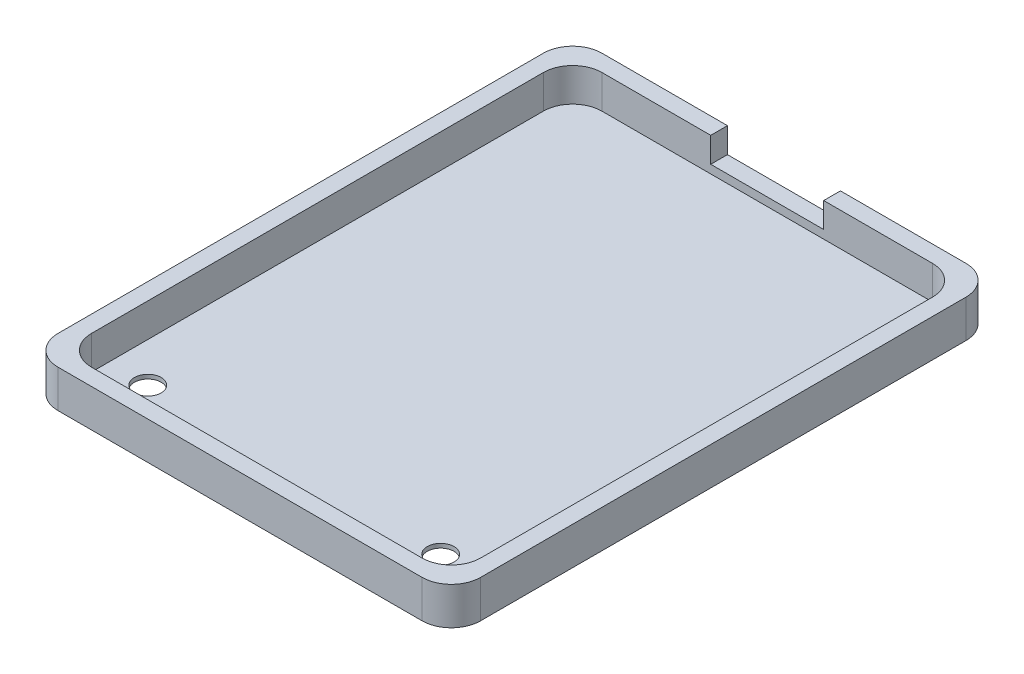
from build123d import *

# Parameters (mm, degrees)
BOSS_EXTRUDE1_DEPTH = 4.5
CUT_EXTRUDE1_DEPTH  = 4
SKETCH3_W           = 13.5
SKETCH3_H           = 6
CUT_EXTRUDE3_DEPTH  = 15
SKETCH4_R           = 1.6
CUT_EXTRUDE4_DEPTH  = 40


with BuildPart() as part:
    # Sketch1 → Boss-Extrude1 (new body)
    with BuildSketch(Plane(origin=(0, 0, 0), x_dir=(1, 0, 0), z_dir=(0, 1, 0))):
        with BuildLine():
            Line((3.5, 0), (47, 0))
            ThreePointArc((47, 0), (49.474873734, 1.025126266), (50.5, 3.5))
            Line((50.5, 3.5), (50.5, 61.5))
            ThreePointArc((50.5, 61.5), (49.474873734, 63.974873734), (47, 65))
            Line((47, 65), (3.5, 65))
            ThreePointArc((3.5, 65), (1.025126266, 63.974873734), (0, 61.5))
            Line((0, 61.5), (0, 3.5))
            ThreePointArc((0, 3.5), (1.025126266, 1.025126266), (3.5, 0))
        make_face()
    extrude(amount=BOSS_EXTRUDE1_DEPTH)

    # Sketch2 → Cut-Extrude1 (cut)
    with BuildSketch(Plane(origin=(0, 4.5, 0), x_dir=(1, 0, 0), z_dir=(0, 1, 0))):
        with BuildLine():
            Line((5.5, 2), (45, 2))
            ThreePointArc((45, 2), (47.474873734, 3.025126266), (48.5, 5.5))
            Line((48.5, 5.5), (48.5, 59.5))
            ThreePointArc((48.5, 59.5), (47.474873734, 61.974873734), (45, 63))
            Line((45, 63), (5.5, 63))
            ThreePointArc((5.5, 63), (3.025126266, 61.974873734), (2, 59.5))
            Line((2, 59.5), (2, 5.5))
            ThreePointArc((2, 5.5), (3.025126266, 3.025126266), (5.5, 2))
        make_face()
    extrude(amount=-CUT_EXTRUDE1_DEPTH, mode=Mode.SUBTRACT)

    # Sketch3 → Cut-Extrude3 (cut)
    with BuildSketch(Plane(origin=(0, 0, -65), x_dir=(-1, 0, 0), z_dir=(0, 0, -1))):
        with Locations((-25.25, 4.5)):
            Rectangle(SKETCH3_W, SKETCH3_H)
    extrude(amount=-CUT_EXTRUDE3_DEPTH, mode=Mode.SUBTRACT)

    # Sketch4 → Cut-Extrude4 (cut)
    with BuildSketch(Plane(origin=(0, 0.5, 0), x_dir=(1, 0, 0), z_dir=(0, 1, 0))):
        with Locations(Location((6.724572176, 7.5, 0), (0, 0, 270))):
            Circle(SKETCH4_R)
        with Locations(Location((41.724572176, 7.5, 0), (0, 0, 270))):
            Circle(SKETCH4_R)
    extrude(amount=-CUT_EXTRUDE4_DEPTH, mode=Mode.SUBTRACT)


solid = part.part
